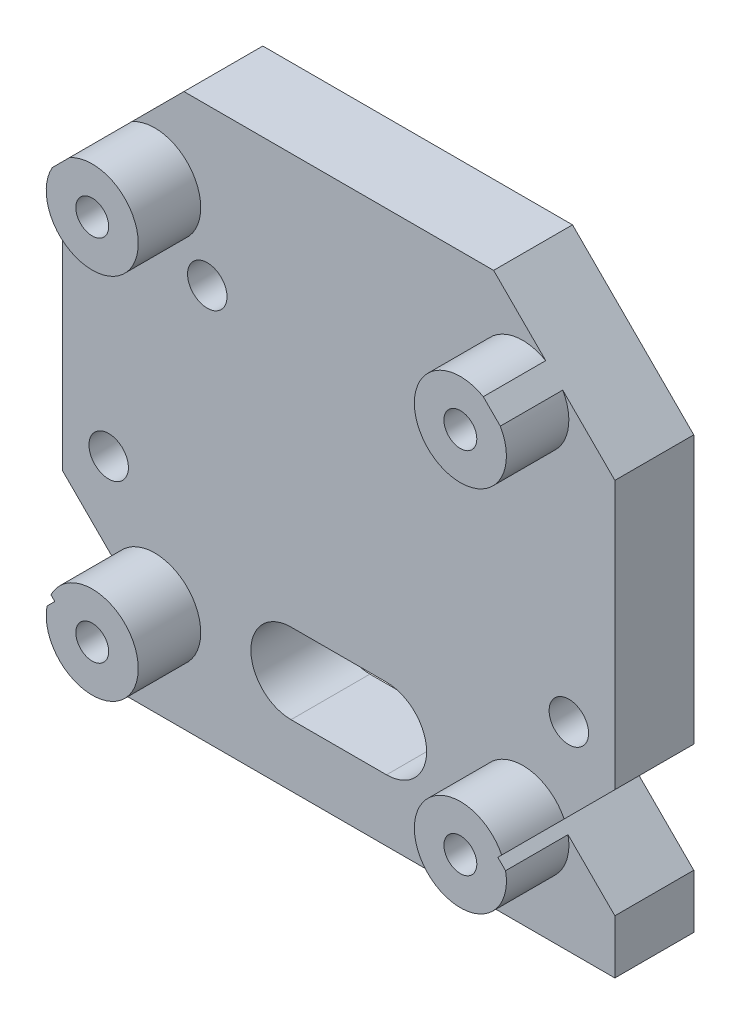
from build123d import *

# Parameters (mm, degrees)
SKETCH1_W           = 42
SKETCH1_H           = 42
SKETCH1_R           = 1.25
BOSS_EXTRUDE1_DEPTH = 6
CUT_EXTRUDE1_DEPTH  = 31.298514815
BOSS_EXTRUDE2_START = 4.75
SKETCH3_R           = 3.5
SKETCH3_R_2         = 1.25
BOSS_EXTRUDE2_DEPTH = 4.75
SKETCH4_R           = 1.5
CUT_EXTRUDE2_DEPTH  = 31.298514815
CUT_EXTRUDE3_DEPTH  = 2.3


with BuildPart() as part:
    # Sketch1 → Boss-Extrude1 (new body)
    with BuildSketch(Plane.XY):
        Rectangle(SKETCH1_W, SKETCH1_H)
        with Locations((-14, 14)):
            Circle(SKETCH1_R, mode=Mode.SUBTRACT)
        with Locations((14, 14)):
            Circle(SKETCH1_R, mode=Mode.SUBTRACT)
        with Locations((14, -14)):
            Circle(SKETCH1_R, mode=Mode.SUBTRACT)
        with Locations((-14, -14)):
            Circle(SKETCH1_R, mode=Mode.SUBTRACT)
    extrude(amount=-BOSS_EXTRUDE1_DEPTH)

    # Sketch2 → Cut-Extrude1 (cut, through all)
    with BuildSketch(Plane.XY):
        with BuildLine():
            Line((-3.631627179, -10.198790609), (3.631230455, -10.198790609))
            ThreePointArc((3.631230455, -10.198790609), (6.681814195, -13.249374349), (3.631230455, -16.29995809))
            Line((3.631230455, -16.29995809), (-3.631627179, -16.29995809))
            ThreePointArc((-3.631627179, -16.29995809), (-6.68221092, -13.249374349), (-3.631627179, -10.198790609))
        make_face()
    extrude(amount=-CUT_EXTRUDE1_DEPTH, mode=Mode.SUBTRACT)

    # Sketch3 → Boss-Extrude2 (add)
    # profile 1 of 4: a face of its own
    with BuildSketch(Plane.XY.offset(BOSS_EXTRUDE2_START)):
        with Locations(Location((-14, 14, 0), (0, 0, 180))):
            Circle(SKETCH3_R)
        with Locations((-14, 14)):
            Circle(SKETCH3_R_2, mode=Mode.SUBTRACT)
    # profile 2 of 4: a face of its own
    with BuildSketch(Plane.XY.offset(BOSS_EXTRUDE2_START)):
        with Locations(Location((14, 14, 0), (0, 0, 180))):
            Circle(SKETCH3_R)
        with Locations((14, 14)):
            Circle(SKETCH3_R_2, mode=Mode.SUBTRACT)
    # profile 3 of 4: a face of its own
    with BuildSketch(Plane.XY.offset(BOSS_EXTRUDE2_START)):
        with Locations(Location((-14, -14, 0), (0, 0, 180))):
            Circle(SKETCH3_R)
        with Locations((-14, -14)):
            Circle(SKETCH3_R_2, mode=Mode.SUBTRACT)
    # profile 4 of 4: a face of its own
    with BuildSketch(Plane.XY.offset(BOSS_EXTRUDE2_START)):
        with Locations(Location((14, -14, 0), (0, 0, 180))):
            Circle(SKETCH3_R)
        with Locations((14, -14)):
            Circle(SKETCH3_R_2, mode=Mode.SUBTRACT)
    extrude(amount=-BOSS_EXTRUDE2_DEPTH)

    # Sketch4 → Cut-Extrude2 (cut, symmetric)
    with BuildSketch(Plane.XY):
        with Locations((-17.5, -5.882662859)):
            Circle(SKETCH4_R)
        with Locations((-10, 9.117337141)):
            Circle(SKETCH4_R)
        Polygon((-21.661099187, -7.93704977), (-16.848148957, -12.75), (-21.661099187, -17.56295023), align=None)
        Polygon((-21.705309187, 11.072359515), (-11.305917145, 21.471751558), (-21.705309187, 21.471751558), align=None)
    cut_extrude2 = extrude(amount=CUT_EXTRUDE2_DEPTH, both=True, mode=Mode.SUBTRACT)

    # Mirror1: Cut-Extrude2 across plane
    add(cut_extrude2.mirror(Plane(origin=(0, 0, 0), x_dir=(0, 0, 1), z_dir=(1, 0, 0))), mode=Mode.SUBTRACT)

    # Sketch5 → Cut-Extrude3 (cut)
    with BuildSketch(Plane(origin=(0, 0, -6), x_dir=(-1, 0, 0), z_dir=(0, 0, -1))):
        Polygon((-13.222967924, 11.100076814), (-11.100076814, 13.222967924), (-11.87710889, 16.12289111), (-14.777032076, 16.899923186), (-16.899923186, 14.777032076), (-16.12289111, 11.87710889), align=None)
        Polygon((13.222967924, 11.100076814), (16.12289111, 11.87710889), (16.899923186, 14.777032076), (14.777032076, 16.899923186), (11.87710889, 16.12289111), (11.100076814, 13.222967924), align=None)
        Polygon((15.5011107, -16.6), (17.0022214, -14), (15.5011107, -11.4), (12.4988893, -11.4), (10.9977786, -14), (12.4988893, -16.6), align=None)
        Polygon((-15.5011107, -16.6), (-12.4988893, -16.6), (-10.9977786, -14), (-12.4988893, -11.4), (-15.5011107, -11.4), (-17.0022214, -14), align=None)
    extrude(amount=-CUT_EXTRUDE3_DEPTH, mode=Mode.SUBTRACT)


solid = part.part
